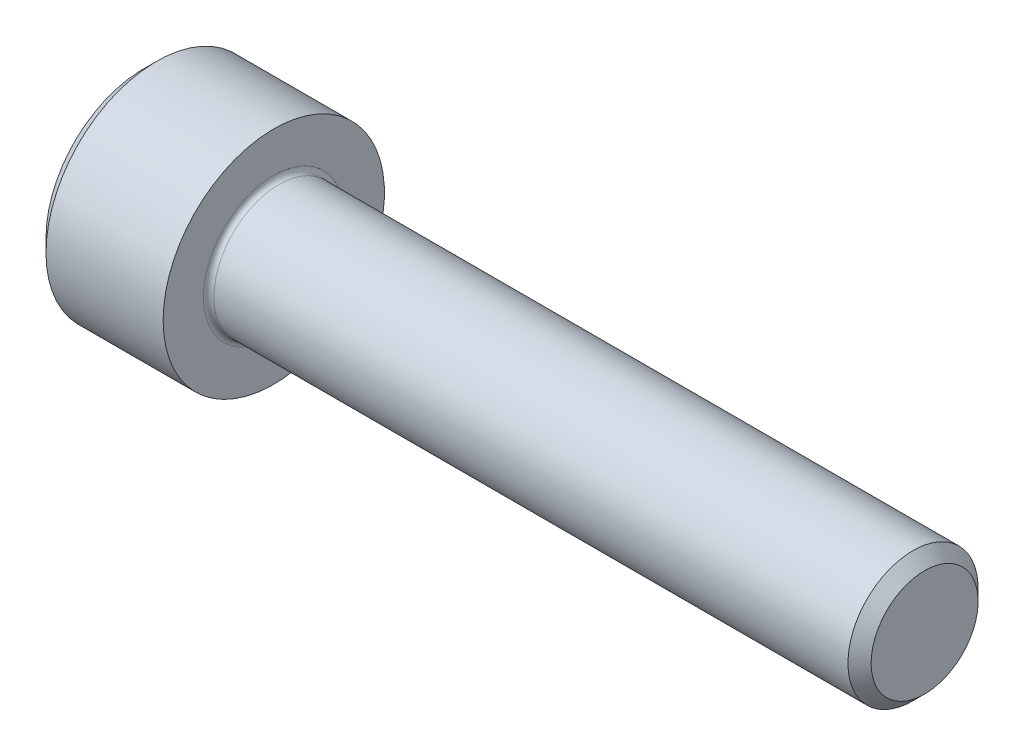
from build123d import *

# Parameters (mm, degrees)
FILLET1_R = 0.2


with BuildPart() as part:
    # BodySke → Base-Revolve (revolve)
    with BuildSketch(Plane.XY, mode=Mode.PRIVATE) as base_revolve_sk:
        Polygon((0, 0), (0, 3.75), (0.5, 4.25), (5, 4.25), (5, 2.5), (29.555, 2.5), (30, 2.055), (30, 0), align=None)
    revolve(base_revolve_sk.sketch.rotate(Axis((-31.75, 0, 0), (1, 0, 0)), 90), axis=Axis((-31.75, 0, 0), (1, 0, 0)))

    # Fillet1
    fillet1_edges = [part.edges().sort_by_distance(p)[0] for p in [
        (5, 0, -2.5),
    ]]
    fillet(fillet1_edges, radius=FILLET1_R)


solid = part.part
